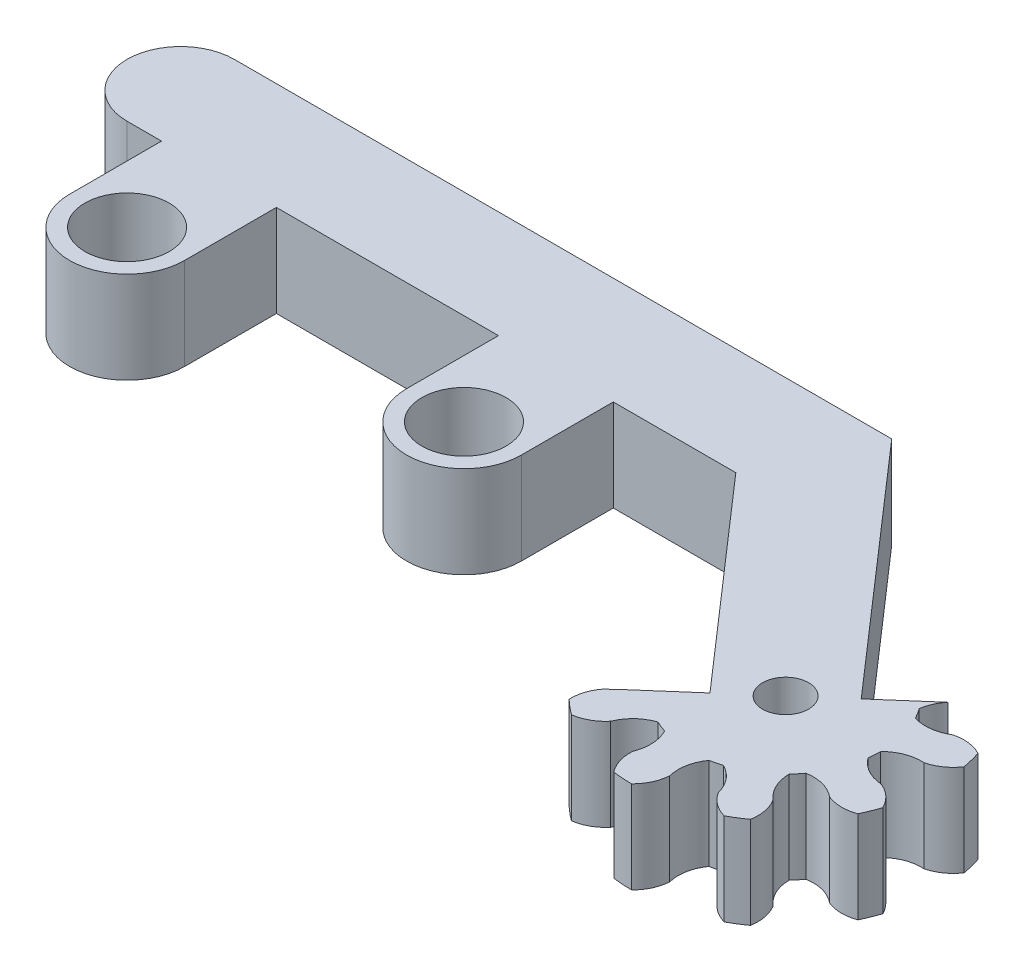
from build123d import *

# Parameters (mm, degrees)
CROQUIS1_R              = 2.75
SALIENTE_EXTRUIR1_DEPTH = 6
CROQUIS2_R              = 1.5
CORTAR_EXTRUIR1_DEPTH   = 62.68062905
SALIENTE_EXTRUIR2_START = -6
SALIENTE_EXTRUIR2_DEPTH = 6
CORTAR_EXTRUIR2_DEPTH   = 71.114192572


with BuildPart() as part:
    # Croquis1 → Saliente-Extruir1 (new body)
    with BuildSketch(Plane(origin=(0, 0, 0), x_dir=(1, 0, 0), z_dir=(0, 1, 0))):
        with BuildLine():
            Line((42.930999161, 0), (56.636539912, -15.69811875))
            ThreePointArc((56.636539912, -15.69811875), (56.30188125, -20.636539912), (51.363460088, -20.30188125))
            Line((51.363460088, -20.30188125), (39.75, -7))
            Line((39.75, -7), (31.75, -7))
            Line((31.75, -7), (31.75, -13))
            ThreePointArc((31.75, -13), (28, -16.75), (24.25, -13))
            Line((24.25, -13), (24.25, -7))
            Line((24.25, -7), (9.75, -7))
            Line((9.75, -7), (9.75, -13))
            ThreePointArc((9.75, -13), (6, -16.75), (2.25, -13))
            Line((2.25, -13), (2.25, -7))
            Line((2.25, -7), (0, -7))
            ThreePointArc((0, -7), (-3.5, -3.5), (0, 0))
            Line((0, 0), (42.930999161, 0))
        make_face()
        with Locations(Location((28, -13, 0), (0, 0, 270))):
            Circle(CROQUIS1_R, mode=Mode.SUBTRACT)
        with Locations(Location((6, -13, 0), (0, 0, 270))):
            Circle(CROQUIS1_R, mode=Mode.SUBTRACT)
    extrude(amount=SALIENTE_EXTRUIR1_DEPTH)

    # Croquis2 → Cortar-Extruir1 (cut, through all)
    with BuildSketch(Plane(origin=(0, 6, 0), x_dir=(1, 0, 0), z_dir=(0, 1, 0))):
        with Locations(Location((54, -18, 0), (0, 0, 270))):
            Circle(CROQUIS2_R)
    extrude(amount=-CORTAR_EXTRUIR1_DEPTH, mode=Mode.SUBTRACT)

    # Croquis3 → Saliente-Extruir2 (add)
    with BuildSketch(Plane(origin=(0, 6, 0), x_dir=(1, 0, 0), z_dir=(0, 1, 0)).offset(SALIENTE_EXTRUIR2_START)):
        with BuildLine():
            Line((51.363460088, -20.30188125), (46.467028822, -24.576803572))
            ThreePointArc((46.467028822, -24.576803572), (60.576803572, -25.532971178), (61.532971178, -11.423196428))
            Line((61.532971178, -11.423196428), (56.636539912, -15.69811875))
            ThreePointArc((56.636539912, -15.69811875), (56.30188125, -20.636539912), (51.363460088, -20.30188125))
        make_face()
    extrude(amount=SALIENTE_EXTRUIR2_DEPTH)

    # Croquis4 → Cortar-Extruir2 (cut, through all)
    with BuildSketch(Plane(origin=(0, 6, 0), x_dir=(1, 0, 0), z_dir=(0, 1, 0))):
        with BuildLine():
            ThreePointArc((44.471919223, -21.035733308), (45.527460474, -23.311880456), (47.116349204, -25.25364403))
            ThreePointArc((47.116349204, -25.25364403), (47.255351375, -24.311140987), (47.722398468, -23.480779257))
            ThreePointArc((47.722398468, -23.480779257), (48.523826653, -22.694010434), (48.921868449, -21.643841379))
            ThreePointArc((48.921868449, -21.643841379), (48.704493345, -21.320031523), (48.507736999, -20.983294683))
            ThreePointArc((48.507736999, -20.983294683), (47.389059112, -20.884036937), (46.331721606, -21.262626046))
            ThreePointArc((46.331721606, -21.262626046), (45.380828681, -21.321245459), (44.471919223, -21.035733308))
        make_face()
        with BuildLine():
            ThreePointArc((48.075979996, -26.056425199), (50.267816532, -27.277435344), (52.694594509, -27.914429711))
            ThreePointArc((52.694594509, -27.914429711), (52.253060238, -27.070225306), (52.142834895, -26.123925161))
            ThreePointArc((52.142834895, -26.123925161), (52.328752805, -25.016348145), (52.0335015, -23.932780435))
            ThreePointArc((52.0335015, -23.932780435), (51.667310689, -23.798582639), (51.310202513, -23.641807292))
            ThreePointArc((51.310202513, -23.641807292), (50.346830851, -24.219048452), (49.713955935, -25.146820868))
            ThreePointArc((49.713955935, -25.146820868), (48.979123025, -25.753165807), (48.075979996, -26.056425199))
        make_face()
        with BuildLine():
            ThreePointArc((53.94281506, -27.999836493), (56.433739822, -27.699325259), (58.771460342, -26.788240222))
            ThreePointArc((58.771460342, -26.788240222), (57.918040714, -26.364791844), (57.272645269, -25.664007776))
            ThreePointArc((57.272645269, -25.664007776), (56.772038582, -24.658679342), (55.896270139, -23.955599013))
            ThreePointArc((55.896270139, -23.955599013), (55.521136064, -24.062272273), (55.140079244, -24.145341273))
            ThreePointArc((55.140079244, -24.145341273), (54.699989039, -25.178594837), (54.73331342, -26.30117303))
            ThreePointArc((54.73331342, -26.30117303), (54.495221721, -27.223640338), (53.94281506, -27.999836493))
        make_face()
        with BuildLine():
            ThreePointArc((59.831492828, -26.123650128), (61.670057221, -24.416402593), (63.025790501, -22.305241669))
            ThreePointArc((63.025790501, -22.305241669), (62.086462807, -22.464292206), (61.152416384, -22.276699911))
            ThreePointArc((61.152416384, -22.276699911), (60.156499839, -21.75762135), (59.034728037, -21.703581191))
            ThreePointArc((59.034728037, -21.703581191), (58.793939164, -22.010379949), (58.534484453, -22.30156376))
            ThreePointArc((58.534484453, -22.30156376), (58.785775205, -23.396161985), (59.472570103, -24.284759241))
            ThreePointArc((59.472570103, -24.284759241), (59.822162551, -25.170997759), (59.831492828, -26.123650128))
        make_face()
        with BuildLine():
            ThreePointArc((63.49273854, -21.144505527), (63.976673456, -18.682632222), (63.832575464, -16.177787128))
            ThreePointArc((63.832575464, -16.177787128), (63.166130956, -16.858584682), (62.300207541, -17.255838039))
            ThreePointArc((62.300207541, -17.255838039), (61.189387409, -17.42127972), (60.250090948, -18.036921234))
            ThreePointArc((60.250090948, -18.036921234), (60.235620444, -18.426658791), (60.196870723, -18.814735096))
            ThreePointArc((60.196870723, -18.814735096), (61.043557906, -19.552578664), (62.121491012, -19.867781033))
            ThreePointArc((62.121491012, -19.867781033), (62.925235175, -20.379277769), (63.49273854, -21.144505527))
        make_face()
        with BuildLine():
            ThreePointArc((63.528080777, -14.964266692), (62.472539526, -12.688119544), (60.883650796, -10.74635597))
            ThreePointArc((60.883650796, -10.74635597), (60.744648625, -11.688859013), (60.277601532, -12.519220743))
            ThreePointArc((60.277601532, -12.519220743), (59.476173347, -13.305989566), (59.078131551, -14.356158621))
            ThreePointArc((59.078131551, -14.356158621), (59.295506655, -14.679968477), (59.492263001, -15.016705317))
            ThreePointArc((59.492263001, -15.016705317), (60.610940888, -15.115963063), (61.668278394, -14.737373954))
            ThreePointArc((61.668278394, -14.737373954), (62.619171319, -14.678754541), (63.528080777, -14.964266692))
        make_face()
    extrude(amount=-CORTAR_EXTRUIR2_DEPTH, mode=Mode.SUBTRACT)


solid = part.part
